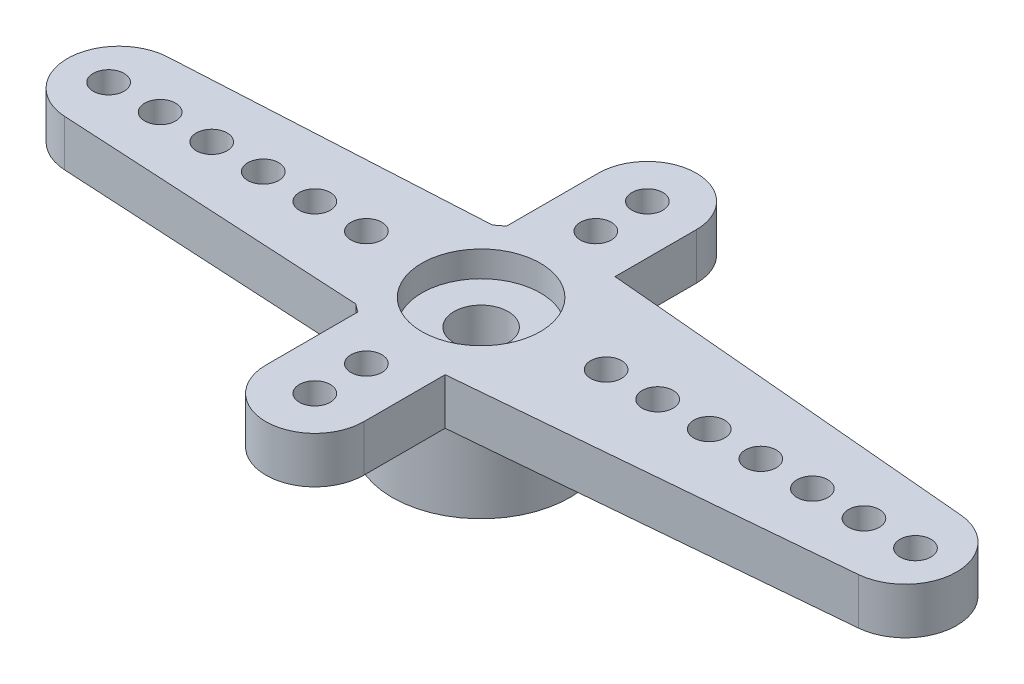
from build123d import *

# Parameters (mm, degrees)
RESSALTO_EXTRUS_O1_DEPTH = 1.8
ESBO_O2_R                = 3.45
RESSALTO_EXTRUS_O2_DEPTH = 3.2
FURO1_D                  = 1.2
PADR_O_LINEAR1_COUNT     = 6
PADR_O_LINEAR1_PITCH     = 2
RESSALTO_EXTRUS_O3_DEPTH = 1.8
FURO2_D                  = 1.2
PADR_O_LINEAR2_COUNT     = 7
PADR_O_LINEAR2_PITCH     = 2
RESSALTO_EXTRUS_O4_DEPTH = 1.8
FURO3_D                  = 1.2
PADR_O_LINEAR3_COUNT     = 2
PADR_O_LINEAR3_PITCH     = 2
PADR_OCIRCULAR1_COUNT    = 2
PADR_OCIRCULAR1_COPY_1_D = 1.2
FURO4_D                  = 4.95
FURO4_DEPTH              = 2
FURO5_D                  = 4.6
FURO5_DEPTH              = 1
FURO6_D                  = 2.1
RESSALTO_EXTRUS_O5_START = -2
RESSALTO_EXTRUS_O5_DEPTH = 2
PADR_OCIRCULAR2_COUNT    = 60


with BuildPart() as part:
    # Esboço1 → Ressalto-extrusão1 (new body)
    with BuildSketch(Plane(origin=(0, 0, 0), x_dir=(1, 0, 0), z_dir=(0, 1, 0))):
        with BuildLine():
            Line((-14.159121967, 1.99702088), (-2.209072203, 2.65))
            ThreePointArc((-2.209072203, 2.65), (3.45, 0), (-2.209072203, -2.65))
            Line((-2.209072203, -2.65), (-14.159121967, -1.99702088))
            ThreePointArc((-14.159121967, -1.99702088), (-16.05, 0), (-14.159121967, 1.99702088))
        make_face()
    extrude(amount=-RESSALTO_EXTRUS_O1_DEPTH)

    # Esboço2 → Ressalto-extrusão2 (add)
    with BuildSketch(Plane.XZ.offset(1.8)):
        with Locations(Location((0, 0, 0), (0, 0, 90))):
            Circle(ESBO_O2_R)
    extrude(amount=RESSALTO_EXTRUS_O2_DEPTH)

    # Furo1 (through all)
    with Locations(Plane(origin=(0, 0, 0), x_dir=(1, 0, 0), z_dir=(0, 1, 0))):
        with Locations((-14.45, 0)):
            furo1 = Hole(FURO1_D / 2)

    # Padrão linear1: Furo1 ×6
    with Locations(*[(i * PADR_O_LINEAR1_PITCH, 0, 0) for i in range(1, PADR_O_LINEAR1_COUNT)]):
        add(furo1, mode=Mode.SUBTRACT)

    # Esboço12 → Ressalto-extrusão3 (add)
    with BuildSketch(Plane(origin=(0, 0, 0), x_dir=(1, 0, 0), z_dir=(0, 1, 0))):
        with BuildLine():
            Line((0.304103343, 3.436571134), (16.626291793, 1.99221515))
            ThreePointArc((16.626291793, 1.99221515), (18.45, 0), (16.626291793, -1.99221515))
            Line((16.626291793, -1.99221515), (0.304103343, -3.436571134))
            ThreePointArc((0.304103343, -3.436571134), (3.45, 0), (0.304103343, 3.436571134))
        make_face()
    extrude(amount=-RESSALTO_EXTRUS_O3_DEPTH)

    # Furo2 (through all)
    with Locations(Plane(origin=(0, 0, 0), x_dir=(1, 0, 0), z_dir=(0, 1, 0))):
        with Locations((16.85, 0)):
            furo2 = Hole(FURO2_D / 2)

    # Padrão linear2: Furo2 ×7
    with Locations(*[(-i * PADR_O_LINEAR2_PITCH, 0, 0) for i in range(1, PADR_O_LINEAR2_COUNT)]):
        add(furo2, mode=Mode.SUBTRACT)

    # Esboço16 → Ressalto-extrusão4 (add)
    with BuildSketch(Plane(origin=(0, 0, 0), x_dir=(1, 0, 0), z_dir=(0, 1, 0))):
        with BuildLine():
            Line((-1.9, -6.45), (-1.9, 6.45))
            ThreePointArc((-1.9, 6.45), (0, 8.35), (1.9, 6.45))
            Line((1.9, 6.45), (1.9, -6.45))
            ThreePointArc((1.9, -6.45), (0, -8.35), (-1.9, -6.45))
        make_face()
    extrude(amount=-RESSALTO_EXTRUS_O4_DEPTH)

    # Furo3 (through all)
    with Locations(Plane(origin=(0, 0, 0), x_dir=(1, 0, 0), z_dir=(0, 1, 0))):
        with Locations((0, -6.45)):
            furo3 = Hole(FURO3_D / 2)

    # Padrão linear3: Furo3 ×2
    with Locations(*[(0, 0, -i * PADR_O_LINEAR3_PITCH) for i in range(1, PADR_O_LINEAR3_COUNT)]):
        add(furo3, mode=Mode.SUBTRACT)

    # PadrãoCircular1: Furo3 ×2 about axis
    padr_ocircular1_axis = Axis((0, 0, 0), (0, 1, 0))
    for i in range(1, PADR_OCIRCULAR1_COUNT):
        add(furo3.rotate(padr_ocircular1_axis, i * 360 / PADR_OCIRCULAR1_COUNT), mode=Mode.SUBTRACT)

    # PadrãoCircular1 copy 1 (through all)
    with Locations(Plane(origin=(0, 0, 2), x_dir=(-1, 0, 0), z_dir=(0, 1, 0))):
        with Locations((0, -6.45)):
            Hole(PADR_OCIRCULAR1_COPY_1_D / 2)

    # Furo4
    with Locations(Plane(origin=(0, -5, 0), x_dir=(-1, 0, 0), z_dir=(0, -1, 0))):
        with Locations((0, 0)):
            Hole(FURO4_D / 2, depth=FURO4_DEPTH)

    # Furo5
    with Locations(Plane(origin=(0, 0, 0), x_dir=(1, 0, 0), z_dir=(0, 1, 0))):
        with Locations((0, 0)):
            Hole(FURO5_D / 2, depth=FURO5_DEPTH)

    # Furo6 (through all)
    with Locations(Plane(origin=(0, 0, 0), x_dir=(1, 0, 0), z_dir=(0, 1, 0))):
        with Locations((0, 0)):
            Hole(FURO6_D / 2)

    # Esboço11 → Ressalto-extrusão5 (add)
    with BuildSketch(Plane.XZ.offset(5).offset(RESSALTO_EXTRUS_O5_START)):
        with BuildLine():
            Line((-0.098056786, 2.473056786), (0, 2.375))
            Line((0, 2.375), (0.098056786, 2.473056786))
            ThreePointArc((0.098056786, 2.473056786), (0, 2.475), (-0.098056786, 2.473056786))
        make_face()
    ressalto_extrus_o5 = extrude(amount=RESSALTO_EXTRUS_O5_DEPTH)

    # PadrãoCircular2: Ressalto-extrusão5 ×60 about axis
    padr_ocircular2_axis = Axis((0, 0, 0), (0, 1, 0))
    for i in range(1, PADR_OCIRCULAR2_COUNT):
        add(ressalto_extrus_o5.rotate(padr_ocircular2_axis, i * 360 / PADR_OCIRCULAR2_COUNT))


solid = part.part
